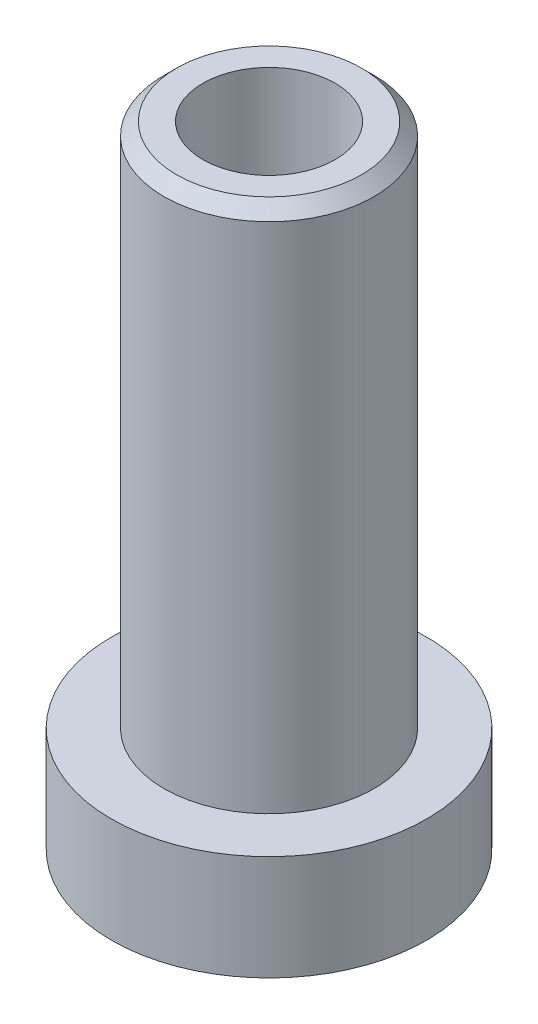
from build123d import *

# Parameters (mm, degrees)
SKETCH1_R           = 0.75
BOSS_EXTRUDE1_DEPTH = 0.5
SKETCH2_R           = 0.5
BOSS_EXTRUDE2_DEPTH = 2.5
CHAMFER1_SIZE       = 0.06
CUT_EXTRUDE1_REACH  = 5.182
SKETCH3_R           = 0.315


with BuildPart() as part:
    # Sketch1 → Boss-Extrude1 (new body)
    with BuildSketch(Plane(origin=(0, 0, 0), x_dir=(1, 0, 0), z_dir=(0, 1, 0))):
        with Locations(Location((0, 0, 0), (0, 0, 270))):
            Circle(SKETCH1_R)
    extrude(amount=BOSS_EXTRUDE1_DEPTH)

    # Sketch2 → Boss-Extrude2 (add)
    with BuildSketch(Plane(origin=(0, 0.5, 0), x_dir=(1, 0, 0), z_dir=(0, 1, 0))):
        with Locations(Location((0, 0, 0), (0, 0, 270))):
            Circle(SKETCH2_R)
    extrude(amount=BOSS_EXTRUDE2_DEPTH)

    # Chamfer1
    chamfer1_edges = [part.edges().sort_by_distance(p)[0] for p in [
        (0, 3, -0.5),
    ]]
    chamfer(chamfer1_edges, length=CHAMFER1_SIZE)

    # Sketch3 → Cut-Extrude1 (cut, up to next)
    with BuildSketch(Plane.XZ, mode=Mode.PRIVATE) as cut_extrude1_sk1:
        with Locations(Location((0, 0, 0), (0, 0, 270))):
            Circle(SKETCH3_R)
    cut_extrude1_tool1 = extrude(cut_extrude1_sk1.sketch, amount=-CUT_EXTRUDE1_REACH, mode=Mode.PRIVATE) & part.part
    add(cut_extrude1_tool1.solids().sort_by_distance((0, 0, 0))[0], mode=Mode.SUBTRACT)


solid = part.part
